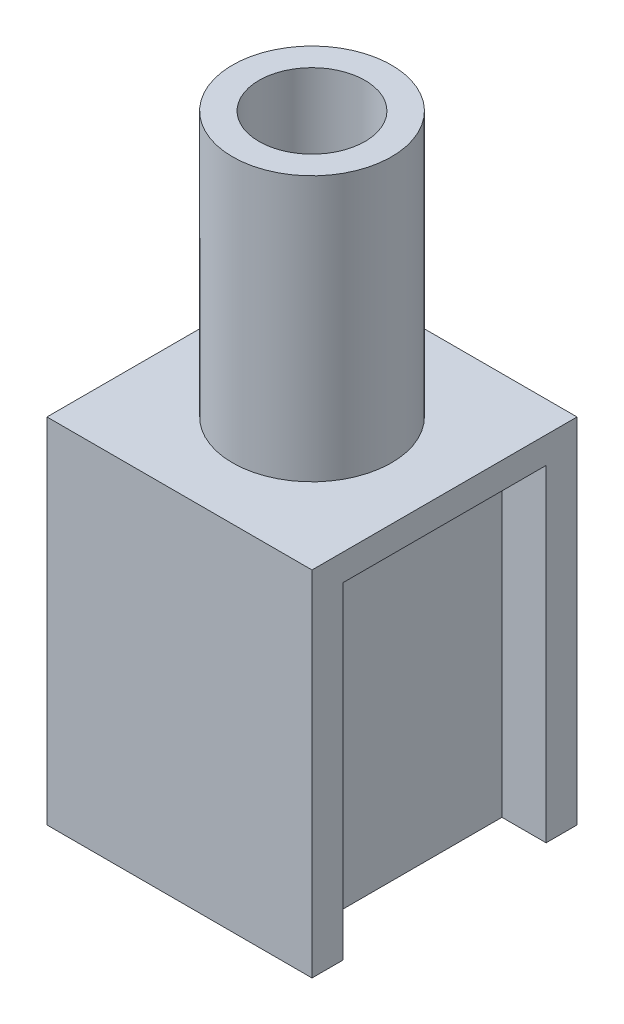
from build123d import *

# Parameters (mm, degrees)
SKETCH1_W           = 30
SKETCH1_H           = 30
BOSS_EXTRUDE1_DEPTH = 40
SKETCH2_R           = 9
BOSS_EXTRUDE2_DEPTH = 30
SKETCH3_R           = 6
CUT_EXTRUDE1_DEPTH  = 60
SKETCH4_W           = 23
SKETCH4_H           = 37
CUT_EXTRUDE2_DEPTH  = 5
SKETCH5_W           = 23
SKETCH5_H           = 37
CUT_EXTRUDE3_DEPTH  = 5


with BuildPart() as part:
    # Sketch1 → Boss-Extrude1 (new body)
    with BuildSketch(Plane(origin=(0, 0, 0), x_dir=(1, 0, 0), z_dir=(0, 1, 0))):
        Rectangle(SKETCH1_W, SKETCH1_H)
    extrude(amount=BOSS_EXTRUDE1_DEPTH)

    # Sketch2 → Boss-Extrude2 (add)
    with BuildSketch(Plane(origin=(0, 40, 0), x_dir=(1, 0, 0), z_dir=(0, 1, 0))):
        with Locations(Location((0, 0, 0), (0, 0, 270))):
            Circle(SKETCH2_R)
    extrude(amount=BOSS_EXTRUDE2_DEPTH)

    # Sketch3 → Cut-Extrude1 (cut)
    with BuildSketch(Plane(origin=(0, 70, 0), x_dir=(1, 0, 0), z_dir=(0, 1, 0))):
        with Locations(Location((0, 0, 0), (0, 0, 270))):
            Circle(SKETCH3_R)
    extrude(amount=-CUT_EXTRUDE1_DEPTH, mode=Mode.SUBTRACT)

    # Sketch4 → Cut-Extrude2 (cut)
    with BuildSketch(Plane(origin=(15, 0, 0), x_dir=(0, 0, -1), z_dir=(1, 0, 0))):
        with Locations((0, 18.5)):
            Rectangle(SKETCH4_W, SKETCH4_H)
    extrude(amount=-CUT_EXTRUDE2_DEPTH, mode=Mode.SUBTRACT)

    # Sketch5 → Cut-Extrude3 (cut)
    with BuildSketch(Plane.ZY.offset(15)):
        with Locations((0, 18.5)):
            Rectangle(SKETCH5_W, SKETCH5_H)
    extrude(amount=-CUT_EXTRUDE3_DEPTH, mode=Mode.SUBTRACT)


solid = part.part
